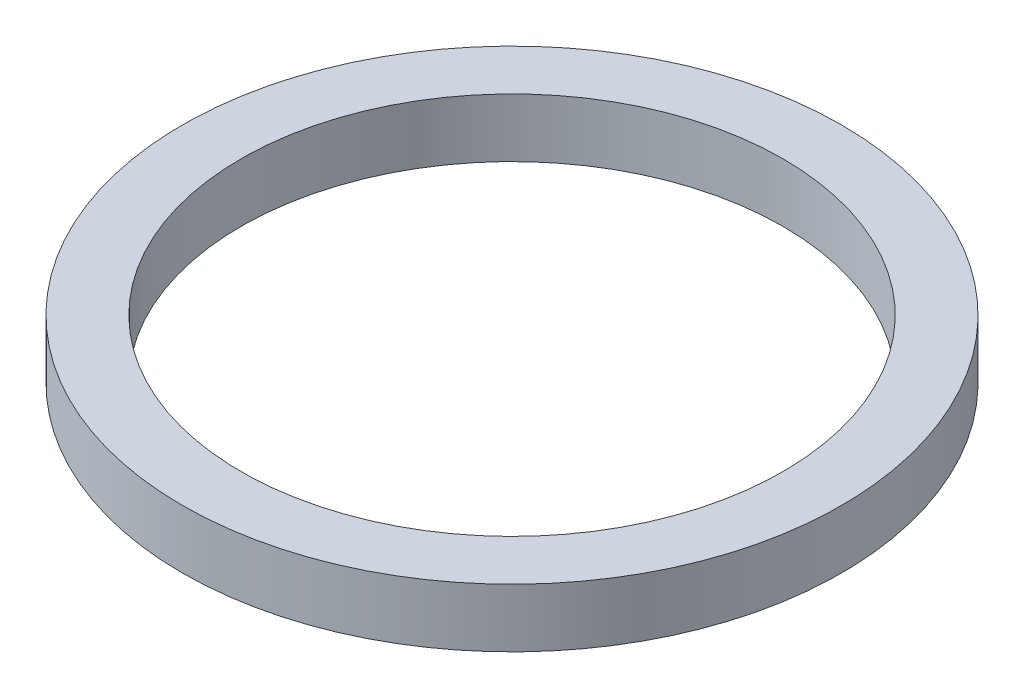
from build123d import *

# Parameters (mm, degrees)
SKETCH1_W = 8
SKETCH1_H = 8


with BuildPart() as part:
    # Sketch1 → Revolve1 (revolve)
    with BuildSketch(Plane.XY):
        with Locations((41, 4)):
            Rectangle(SKETCH1_W, SKETCH1_H)
    revolve(axis=Axis((0, 0, 0), (0, 1, 0)))


solid = part.part
